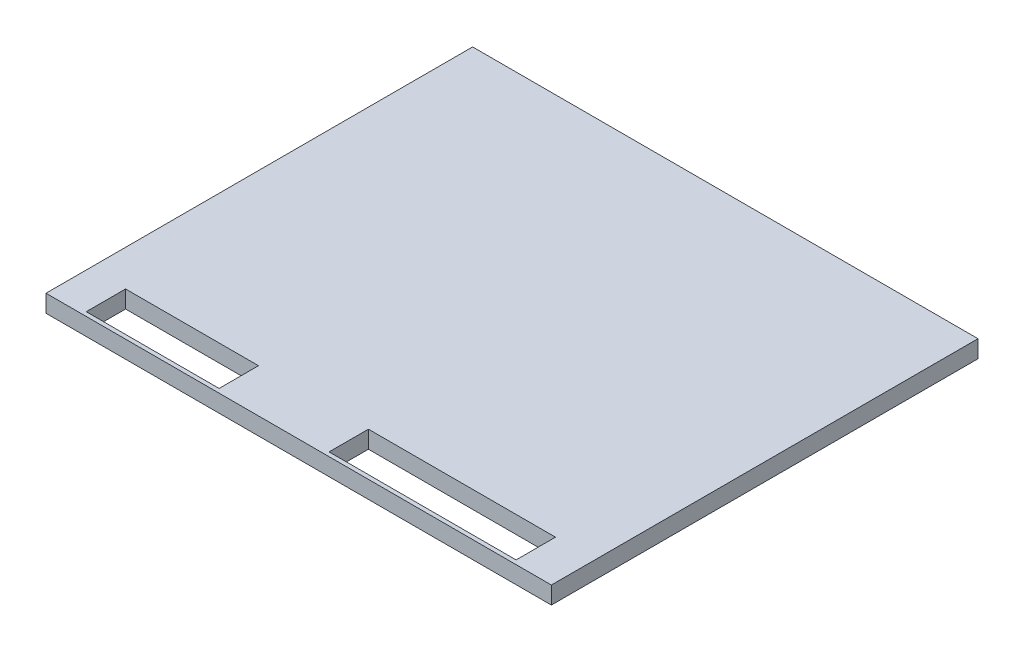
from build123d import *

# Parameters (mm, degrees)
SKETCH_1_W          = 308
SKETCH_1_H          = 260
EXTRUDE_1_DEPTH     = 10.6
SKETCH_2_W          = 114
SKETCH_2_H          = 24
SKETCH_2_W_2        = 81
CUT_EXTRUDE_1_DEPTH = 10.6


with BuildPart() as part:
    # 草图1 → 凸台-拉伸1 (new body)
    with BuildSketch(Plane(origin=(0, 0, 0), x_dir=(1, 0, 0), z_dir=(0, 1, 0))):
        with Locations((51.444234405, -15.784499055)):
            Rectangle(SKETCH_1_W, SKETCH_1_H)
    extrude(amount=EXTRUDE_1_DEPTH)

    # 草图2 → 切除-拉伸1 (cut)
    with BuildSketch(Plane(origin=(0, 0, 0), x_dir=(1, 0, 0), z_dir=(0, 1, 0))):
        with Locations((124.444234405, -131.284499055)):
            Rectangle(SKETCH_2_W, SKETCH_2_H)
        with Locations((-40.055765595, -131.284499055)):
            Rectangle(SKETCH_2_W_2, SKETCH_2_H)
    extrude(amount=CUT_EXTRUDE_1_DEPTH, mode=Mode.SUBTRACT)


solid = part.part
